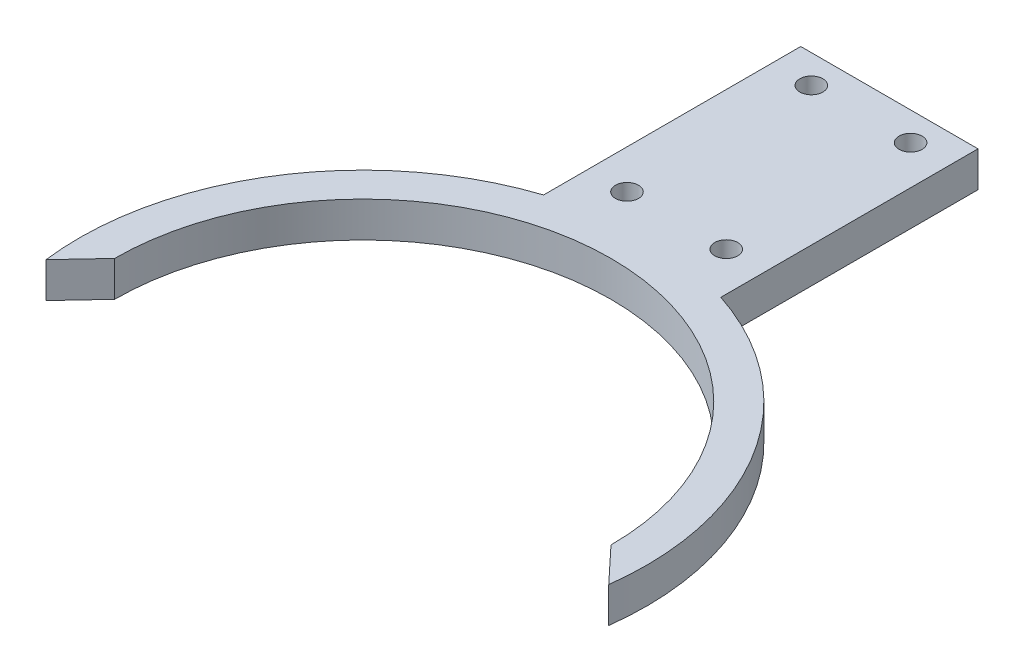
from build123d import *

# Parameters (mm, degrees)
SKETCH1_R           = 1.625
BOSS_EXTRUDE1_DEPTH = 5


with BuildPart() as part:
    # Sketch1 → Boss-Extrude1 (new body)
    with BuildSketch(Plane(origin=(0, 0, 0), x_dir=(1, 0, 0), z_dir=(0, 1, 0))):
        with BuildLine():
            Line((15, 40), (-10, 40))
            Line((-10, 40), (-10, 3.729833462))
            ThreePointArc((-10, 3.729833462), (-31.308740902, -12.890042764), (-37.186269666, -39.266876922))
            Line((-37.186269666, -39.266876922), (-32.5, -34.266876922))
            ThreePointArc((-32.5, -34.266876922), (2.5, 0.733123078), (37.5, -34.266876922))
            Line((37.5, -34.266876922), (42.186269666, -39.266876922))
            ThreePointArc((42.186269666, -39.266876922), (36.308740902, -12.890042764), (15, 3.729833462))
            Line((15, 3.729833462), (15, 40))
        make_face()
        with Locations(Location((-4.5, 9.992204686, 0), (0, 0, 270))):
            Circle(SKETCH1_R, mode=Mode.SUBTRACT)
        with Locations(Location((-4.5, 35.992204686, 0), (0, 0, 270))):
            Circle(SKETCH1_R, mode=Mode.SUBTRACT)
        with Locations(Location((9.5, 35.992204686, 0), (0, 0, 90))):
            Circle(SKETCH1_R, mode=Mode.SUBTRACT)
        with Locations(Location((9.5, 9.992204686, 0), (0, 0, 90))):
            Circle(SKETCH1_R, mode=Mode.SUBTRACT)
    extrude(amount=BOSS_EXTRUDE1_DEPTH)


solid = part.part
